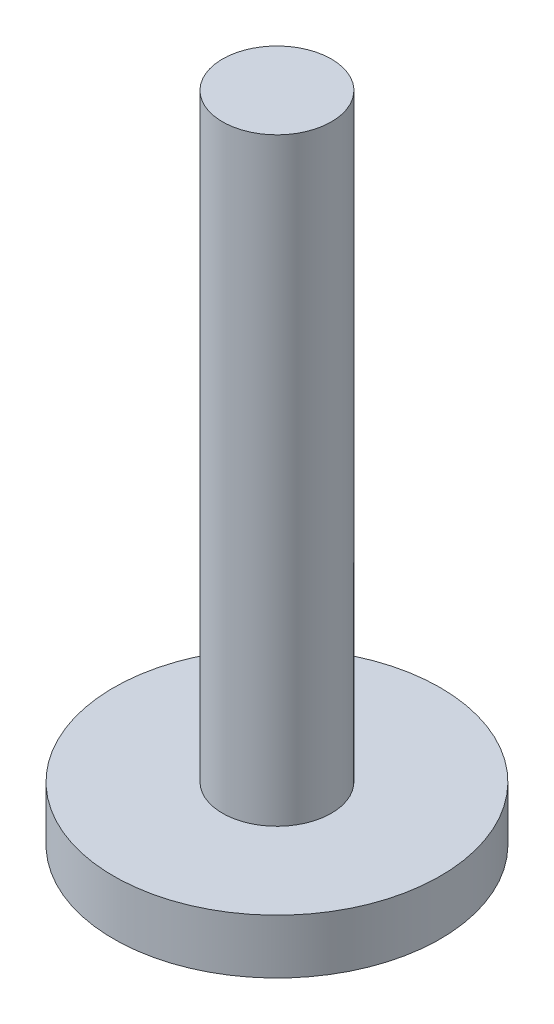
from build123d import *


with BuildPart() as part:
    # Sketch1 → Revolve1 (revolve)
    with BuildSketch(Plane.XY, mode=Mode.PRIVATE) as revolve1_sk:
        Polygon((0, 0), (0, 76.2), (6.35, 76.2), (6.35, 6.35), (19.05, 6.35), (19.05, 0), align=None)
    revolve(revolve1_sk.sketch.rotate(Axis((0, 0, 0), (0, 1, 0)), 90), axis=Axis((0, 0, 0), (0, 1, 0)))


solid = part.part
